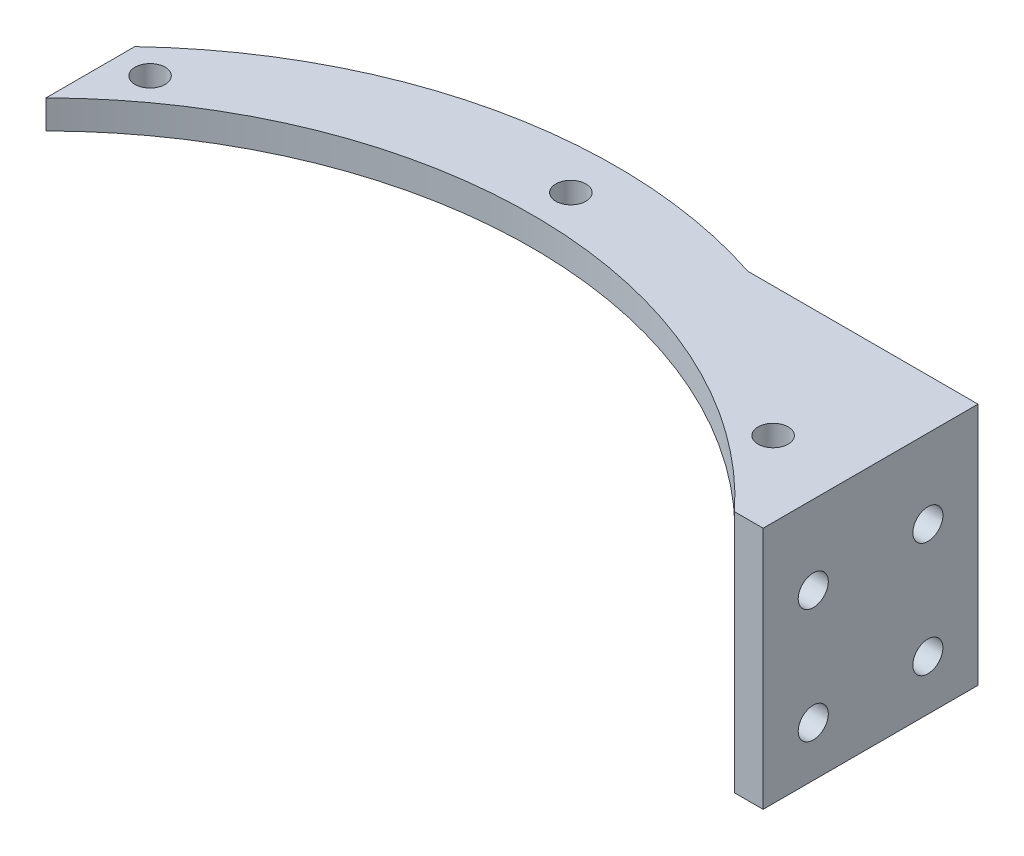
from build123d import *

# Parameters (mm, degrees)
SKETCH1_R           = 2.1
BOSS_EXTRUDE1_DEPTH = 4
SKETCH3_W           = 30
SKETCH3_H           = 34
BOSS_EXTRUDE4_DEPTH = 4
SKETCH4_R           = 2.1
CUT_EXTRUDE1_DEPTH  = 4


with BuildPart() as part:
    # Sketch1 → Boss-Extrude1 (new body)
    with BuildSketch(Plane(origin=(0, 0, 0), x_dir=(1, 0, 0), z_dir=(0, 1, 0))):
        with BuildLine():
            Line((19.185222031, -38.125659411), (19.185222031, -50.522227261))
            ThreePointArc((19.185222031, -50.522227261), (68.648777269, -30.725135996), (117.277214352, -52.493076326))
            Line((117.277214352, -52.493076326), (117.277214352, -22.493076326))
            Line((117.277214352, -22.493076326), (89.144688482, -22.493076326))
            ThreePointArc((89.144688482, -22.493076326), (52.012033316, -20.674538522), (19.185222031, -38.125659411))
        make_face()
        with Locations(Location((67.277214352, -25.33669757, 0), (0, 0, 270))):
            Circle(SKETCH1_R, mode=Mode.SUBTRACT)
        with Locations(Location((23.784262782, -40.590182935, 0), (0, 0, 270))):
            Circle(SKETCH1_R, mode=Mode.SUBTRACT)
        with Locations(Location((110.770165922, -40.590182935, 0), (0, 0, 90))):
            Circle(SKETCH1_R, mode=Mode.SUBTRACT)
    extrude(amount=BOSS_EXTRUDE1_DEPTH)

    # Sketch3 → Boss-Extrude4 (add)
    with BuildSketch(Plane(origin=(117.277214352, 0, 0), x_dir=(0, 0, -1), z_dir=(1, 0, 0))):
        with Locations((-37.493076326, -13)):
            Rectangle(SKETCH3_W, SKETCH3_H)
    extrude(amount=BOSS_EXTRUDE4_DEPTH)

    # Sketch4 → Cut-Extrude1 (cut)
    with BuildSketch(Plane.ZY.offset(-117.277214352)):
        with Locations((29.492163097, -6.999086771)):
            Circle(SKETCH4_R)
        with Locations((45.493989555, -6.999086771)):
            Circle(SKETCH4_R)
        with Locations((45.493989555, -23.000913229)):
            Circle(SKETCH4_R)
        with Locations((29.492163097, -23.000913229)):
            Circle(SKETCH4_R)
    extrude(amount=-CUT_EXTRUDE1_DEPTH, mode=Mode.SUBTRACT)


solid = part.part
